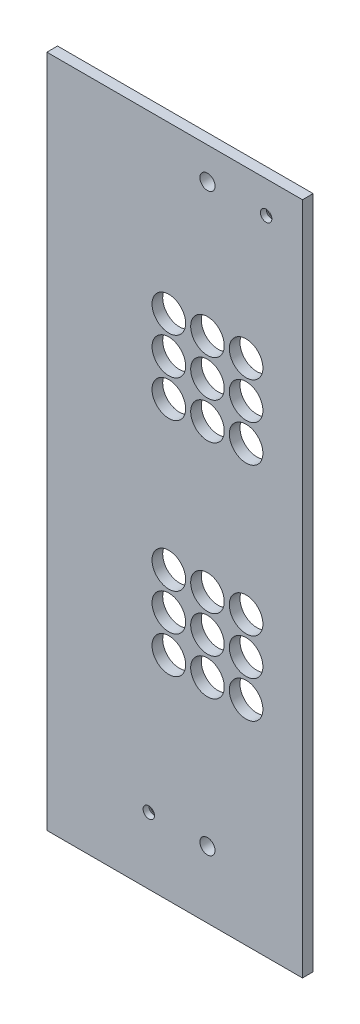
from build123d import *

# Parameters (mm, degrees)
SKETCH1_W                                       = 56.55
SKETCH1_H                                       = 197.425
BOSS_EXTRUDE1_DEPTH                             = 3.175
SKETCH2_R                                       = 5
CUT_EXTRUDE1_DEPTH                              = 103.731270343
SKETCH5_W                                       = 3.175
SKETCH5_H                                       = 197.425
BOSS_EXTRUDE2_DEPTH                             = 19.525
SKETCH14_W                                      = 76.075
SKETCH14_H                                      = 3.175
BOSS_EXTRUDE3_DEPTH                             = 3.175
M4_CLEARANCE_HOLE1_D                            = 4.5
CSK_FOR_M3_FLAT_HEAD_MACHINE_SCREW3_D           = 3.4
CSK_FOR_M3_FLAT_HEAD_MACHINE_SCREW3_CSINK_D     = 6.3
CSK_FOR_M3_FLAT_HEAD_MACHINE_SCREW3_CSINK_ANGLE = 90


with BuildPart() as part:
    # Sketch1 → Boss-Extrude1 (new body)
    with BuildSketch(Plane.XY):
        Rectangle(SKETCH1_W, SKETCH1_H)
    extrude(amount=BOSS_EXTRUDE1_DEPTH)

    # Sketch2 → Cut-Extrude1 (cut, through all)
    with BuildSketch(Plane(origin=(0, 0, 0), x_dir=(-1, 0, 0), z_dir=(0, 0, -1))):
        with Locations((-11.5, 30.630837161)):
            Circle(SKETCH2_R)
        with Locations((-11.5, 52.630837161)):
            Circle(SKETCH2_R)
        with Locations((-11.5, 41.630837161)):
            Circle(SKETCH2_R)
        with Locations((0, 52.630837161)):
            Circle(SKETCH2_R)
        with Locations((0, 41.630837161)):
            Circle(SKETCH2_R)
        with Locations((0, 30.630837161)):
            Circle(SKETCH2_R)
        with Locations((11.5, 30.630837161)):
            Circle(SKETCH2_R)
        with Locations((11.5, 41.630837161)):
            Circle(SKETCH2_R)
        with Locations((11.5, 52.630837161)):
            Circle(SKETCH2_R)
        with Locations((-11.5, -35.369162839)):
            Circle(SKETCH2_R)
        with Locations((-11.5, -13.369162839)):
            Circle(SKETCH2_R)
        with Locations((-11.5, -24.369162839)):
            Circle(SKETCH2_R)
        with Locations((0, -13.369162839)):
            Circle(SKETCH2_R)
        with Locations((0, -24.369162839)):
            Circle(SKETCH2_R)
        with Locations((0, -35.369162839)):
            Circle(SKETCH2_R)
        with Locations((11.5, -35.369162839)):
            Circle(SKETCH2_R)
        with Locations((11.5, -13.369162839)):
            Circle(SKETCH2_R)
        with Locations((11.5, -24.369162839)):
            Circle(SKETCH2_R)
    extrude(amount=-CUT_EXTRUDE1_DEPTH, mode=Mode.SUBTRACT)

    # Sketch5 → Boss-Extrude2 (add)
    with BuildSketch(Plane.ZY.offset(28.275)):
        with Locations((1.5875, 0)):
            Rectangle(SKETCH5_W, SKETCH5_H)
    extrude(amount=BOSS_EXTRUDE2_DEPTH)

    # Sketch14 → Boss-Extrude3 (add)
    with BuildSketch(Plane(origin=(0, 98.7125, 0), x_dir=(1, 0, 0), z_dir=(0, 1, 0))):
        with Locations((-9.7625, -1.5875)):
            Rectangle(SKETCH14_W, SKETCH14_H)
    extrude(amount=BOSS_EXTRUDE3_DEPTH)

    # M4 Clearance Hole1 (through all)
    with Locations(Plane.XY.offset(3.175)):
        with Locations((0, 92.3625001), (0, -78.8874999)):
            Hole(M4_CLEARANCE_HOLE1_D / 2)

    # CSK for M3 Flat Head Machine Screw3 (through all)
    with Locations(Plane(origin=(0, 0, 0), x_dir=(-1, 0, 0), z_dir=(0, 0, -1))):
        with Locations((17.4625, -78.8874999), (-17.4625, 92.3625001)):
            CounterSinkHole(CSK_FOR_M3_FLAT_HEAD_MACHINE_SCREW3_D / 2, CSK_FOR_M3_FLAT_HEAD_MACHINE_SCREW3_CSINK_D / 2, counter_sink_angle=CSK_FOR_M3_FLAT_HEAD_MACHINE_SCREW3_CSINK_ANGLE)


solid = part.part
